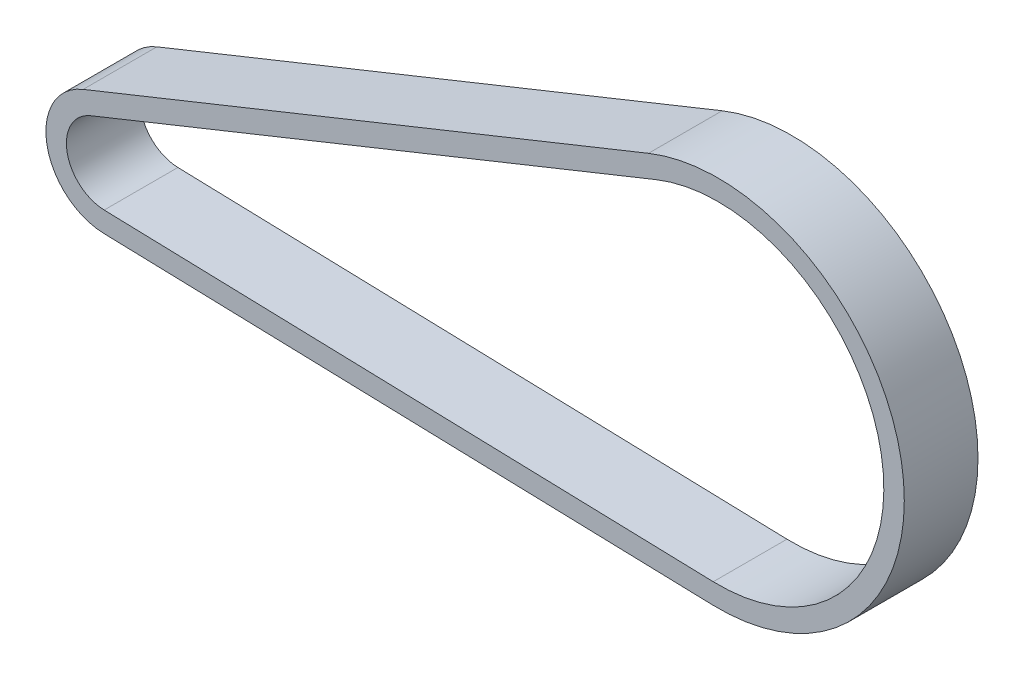
from build123d import *

# Parameters (mm, degrees)
EXTRUDE_THIN1_DEPTH      = 28
EXTRUDE_THIN1_DEPTH_BACK = 8


with BuildPart() as part:
    # Sketch1 → Extrude-Thin1 (new, two sides: drawn at the far end of the back side and taken through both)
    with BuildSketch(Plane.XY.offset(-EXTRUDE_THIN1_DEPTH_BACK)):
        with BuildLine():
            Line((231.112174246, 6.912394388), (-66.376257857, 15.391773115))
            ThreePointArc((-66.376257857, 15.391773115), (-94.097457007, 39.276795278), (-76.368145779, 71.286648284))
            Line((-76.368145779, 71.286648284), (199.758319042, 182.306657851))
            ThreePointArc((199.758319042, 182.306657851), (323.284865716, 113.888955637), (231.112174246, 6.912394388))
        make_face()
        with BuildLine():
            Line((231.397090748, 16.908334693), (-66.091341355, 25.38771342))
            ThreePointArc((-66.091341355, 25.38771342), (-84.253506315, 41.036521044), (-72.637750683, 62.008493704))
            Line((-72.637750683, 62.008493704), (203.488714138, 173.02850327))
            ThreePointArc((203.488714138, 173.02850327), (313.440915024, 112.129229871), (231.397090748, 16.908334693))
        make_face(mode=Mode.SUBTRACT)
    extrude(amount=EXTRUDE_THIN1_DEPTH + EXTRUDE_THIN1_DEPTH_BACK)


solid = part.part
